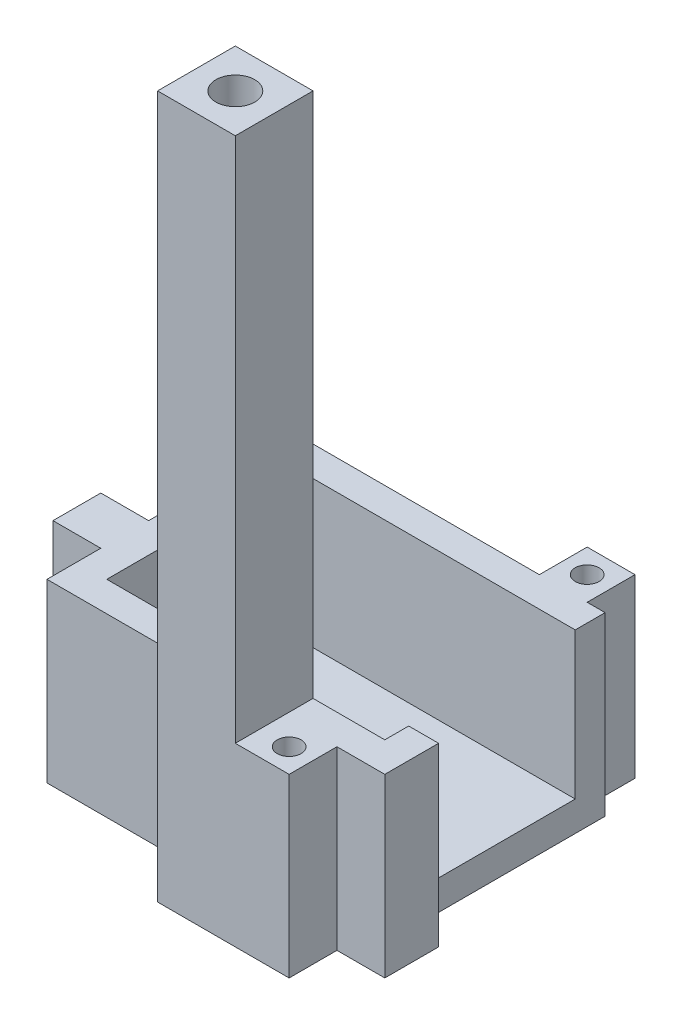
from build123d import *

# Parameters (mm, degrees)
BOSS_EXTRUDE1_DEPTH  = 24.5
SKETCH2_W            = 103
SKETCH2_H            = 41.85
BOSS_EXTRUDE2_DEPTH  = 5
SKETCH3_W            = 46.5
SKETCH3_H            = 27.85
CUT_EXTRUDE1_DEPTH   = 26
SKETCH7_W            = 8
SKETCH7_H            = 3
BOSS_EXTRUDE3_DEPTH  = 8
SKETCH8_R            = 2.5
CUT_EXTRUDE2_DEPTH   = 8
SKETCH9_W            = 8
SKETCH9_H            = 3
BOSS_EXTRUDE4_DEPTH  = 8
SKETCH10_R           = 2.5
CUT_EXTRUDE3_DEPTH   = 8
SKETCH12_W           = 11.5
SKETCH12_H           = 5
CUT_EXTRUDE4_DEPTH   = 8
SKETCH14_W           = 8
SKETCH14_H           = 3
BOSS_EXTRUDE5_DEPTH  = 8
SKETCH15_R           = 2.5
CUT_EXTRUDE5_DEPTH   = 8
SKETCH16_W           = 8
SKETCH16_H           = 29.5
BOSS_EXTRUDE6_DEPTH  = 8
SKETCH17_W           = 14
SKETCH17_H           = 29.5
BOSS_EXTRUDE7_DEPTH  = 8
SKETCH18_R           = 2
CUT_EXTRUDE6_DEPTH   = 10
SKETCH19_W           = 8
SKETCH19_H           = 29.5
BOSS_EXTRUDE8_DEPTH  = 8
SKETCH20_W           = 13
SKETCH20_H           = 13
BOSS_EXTRUDE9_DEPTH  = 88
CUT_EXTRUDE8_DEPTH   = 48
SKETCH23_R           = 2.5
CUT_EXTRUDE9_DEPTH   = 10
SKETCH26_R           = 3.25
CUT_EXTRUDE11_DEPTH  = 117.5
SKETCH25_W           = 8
SKETCH25_H           = 3
CUT_EXTRUDE10_DEPTH  = 8
SKETCH27_W           = 8
SKETCH27_H           = 29.5
BOSS_EXTRUDE11_DEPTH = 8
SKETCH28_R           = 2.5
CUT_EXTRUDE12_DEPTH  = 15


with BuildPart() as part:
    # Sketch1 → Boss-Extrude1 (new body)
    with BuildSketch(Plane(origin=(0, 0, 0), x_dir=(1, 0, 0), z_dir=(0, 1, 0))):
        Polygon((0, 0), (51.5, 0), (51.5, -5), (5, -5), (5, -36.85), (51.5, -36.85), (51.5, -32.85), (56.5, -32.85), (56.5, -41.85), (0, -41.85), align=None)
    extrude(amount=BOSS_EXTRUDE1_DEPTH)

    # Sketch2 → Boss-Extrude2 (add)
    with BuildSketch(Plane.XZ):
        with Locations((51.5, 20.925)):
            Rectangle(SKETCH2_W, SKETCH2_H)
    extrude(amount=BOSS_EXTRUDE2_DEPTH)

    # Sketch3 → Cut-Extrude1 (cut)
    with BuildSketch(Plane(origin=(0, 0, 0), x_dir=(1, 0, 0), z_dir=(0, 1, 0))):
        with Locations((74.75, -18.925)):
            Rectangle(SKETCH3_W, SKETCH3_H)
    extrude(amount=-CUT_EXTRUDE1_DEPTH, mode=Mode.SUBTRACT)

    # Sketch7 → Boss-Extrude3 (add)
    with BuildSketch(Plane.XY.offset(41.85)):
        with Locations((4, -3.5)):
            Rectangle(SKETCH7_W, SKETCH7_H)
    extrude(amount=BOSS_EXTRUDE3_DEPTH)

    # Sketch8 → Cut-Extrude2 (cut)
    with BuildSketch(Plane(origin=(0, -2, 0), x_dir=(1, 0, 0), z_dir=(0, 1, 0))):
        with Locations(Location((4, -45.85, 0), (0, 0, 270))):
            Circle(SKETCH8_R)
    extrude(amount=-CUT_EXTRUDE2_DEPTH, mode=Mode.SUBTRACT)

    # Sketch9 → Boss-Extrude4 (add)
    with BuildSketch(Plane(origin=(0, 0, 0), x_dir=(-1, 0, 0), z_dir=(0, 0, -1))):
        with Locations((-99, -3.5)):
            Rectangle(SKETCH9_W, SKETCH9_H)
    extrude(amount=BOSS_EXTRUDE4_DEPTH)

    # Sketch10 → Cut-Extrude3 (cut)
    with BuildSketch(Plane(origin=(0, -2, 0), x_dir=(1, 0, 0), z_dir=(0, 1, 0))):
        with Locations(Location((99, 3.996680608, 0), (0, 0, 270))):
            Circle(SKETCH10_R)
    extrude(amount=-CUT_EXTRUDE3_DEPTH, mode=Mode.SUBTRACT)

    # Sketch12 → Cut-Extrude4 (cut)
    with BuildSketch(Plane(origin=(0, 0, 0), x_dir=(1, 0, 0), z_dir=(0, 1, 0))):
        with Locations((89.25, -2.5)):
            Rectangle(SKETCH12_W, SKETCH12_H)
    extrude(amount=-CUT_EXTRUDE4_DEPTH, mode=Mode.SUBTRACT)

    # Sketch14 → Boss-Extrude5 (add)
    with BuildSketch(Plane(origin=(0, 0, 0), x_dir=(-1, 0, 0), z_dir=(0, 0, -1))):
        with Locations((-79.5, -3.5)):
            Rectangle(SKETCH14_W, SKETCH14_H)
    extrude(amount=BOSS_EXTRUDE5_DEPTH)

    # Sketch15 → Cut-Extrude5 (cut)
    with BuildSketch(Plane(origin=(0, -2, 0), x_dir=(1, 0, 0), z_dir=(0, 1, 0))):
        with Locations(Location((79.5, 4, 0), (0, 0, 270))):
            Circle(SKETCH15_R)
    extrude(amount=-CUT_EXTRUDE5_DEPTH, mode=Mode.SUBTRACT)

    # Sketch16 → Boss-Extrude6 (add)
    with BuildSketch(Plane(origin=(0, 0, 0), x_dir=(-1, 0, 0), z_dir=(0, 0, -1))):
        with Locations((-44.5, 9.75)):
            Rectangle(SKETCH16_W, SKETCH16_H)
    extrude(amount=BOSS_EXTRUDE6_DEPTH)

    # Sketch17 → Boss-Extrude7 (add)
    with BuildSketch(Plane.XY.offset(41.85)):
        with Locations((41.5, 9.75)):
            Rectangle(SKETCH17_W, SKETCH17_H)
    extrude(amount=BOSS_EXTRUDE7_DEPTH)

    # Sketch18 → Cut-Extrude6 (cut)
    with BuildSketch(Plane(origin=(0, 24.5, 0), x_dir=(1, 0, 0), z_dir=(0, 1, 0))):
        with Locations(Location((44.5, 4, 0), (0, 0, 270))):
            Circle(SKETCH18_R)
        with Locations(Location((44.5, -45.85, 0), (0, 0, 270))):
            Circle(SKETCH18_R)
    extrude(amount=-CUT_EXTRUDE6_DEPTH, mode=Mode.SUBTRACT)

    # Sketch19 → Boss-Extrude8 (add)
    with BuildSketch(Plane.ZY.offset(-34.5)):
        with Locations((45.85, 9.75)):
            Rectangle(SKETCH19_W, SKETCH19_H)
    extrude(amount=BOSS_EXTRUDE8_DEPTH)

    # Sketch20 → Boss-Extrude9 (add)
    with BuildSketch(Plane(origin=(0, 24.5, 0), x_dir=(1, 0, 0), z_dir=(0, 1, 0))):
        with Locations((33, -43.35)):
            Rectangle(SKETCH20_W, SKETCH20_H)
    extrude(amount=BOSS_EXTRUDE9_DEPTH)

    # Sketch22 → Cut-Extrude8 (cut)
    with BuildSketch(Plane(origin=(0, 0, 0), x_dir=(1, 0, 0), z_dir=(0, 1, 0))):
        Polygon((103, 0), (103, 8), (51.5, 8), (51.5, -32.85), (56.5, -32.85), (98, -32.85), (98, -5), (95, -5), (95, 0), align=None)
        Polygon((103, -41.85), (103, -32.85), (98, -32.85), (56.5, -32.85), (56.5, -41.85), align=None)
        Polygon((103, -32.85), (103, 0), (95, 0), (95, -5), (98, -5), (98, -32.85), align=None)
    extrude(amount=-CUT_EXTRUDE8_DEPTH, mode=Mode.SUBTRACT)

    # Sketch23 → Cut-Extrude9 (cut)
    with BuildSketch(Plane.XZ.offset(5)):
        with Locations(Location((44.5, -4, 0), (0, 0, 270))):
            Circle(SKETCH23_R)
    extrude(amount=-CUT_EXTRUDE9_DEPTH, mode=Mode.SUBTRACT)

    # Sketch26 → Cut-Extrude11 (cut)
    with BuildSketch(Plane(origin=(0, 112.5, 0), x_dir=(1, 0, 0), z_dir=(0, 1, 0))):
        with Locations(Location((33, -43.35, 0), (0, 0, 270))):
            Circle(SKETCH26_R)
    extrude(amount=-CUT_EXTRUDE11_DEPTH, mode=Mode.SUBTRACT)

    # Sketch25 → Cut-Extrude10 (cut)
    with BuildSketch(Plane.XY.offset(49.85)):
        with Locations((4, -3.5)):
            Rectangle(SKETCH25_W, SKETCH25_H)
    extrude(amount=-CUT_EXTRUDE10_DEPTH, mode=Mode.SUBTRACT)

    # Sketch27 → Boss-Extrude11 (add)
    with BuildSketch(Plane.ZY):
        with Locations((28.85, 9.75)):
            Rectangle(SKETCH27_W, SKETCH27_H)
    extrude(amount=BOSS_EXTRUDE11_DEPTH)

    # Sketch28 → Cut-Extrude12 (cut)
    with BuildSketch(Plane.XZ.offset(5)):
        with Locations(Location((-4, 28.85, 0), (0, 0, 270))):
            Circle(SKETCH28_R)
    extrude(amount=-CUT_EXTRUDE12_DEPTH, mode=Mode.SUBTRACT)


solid = part.part
